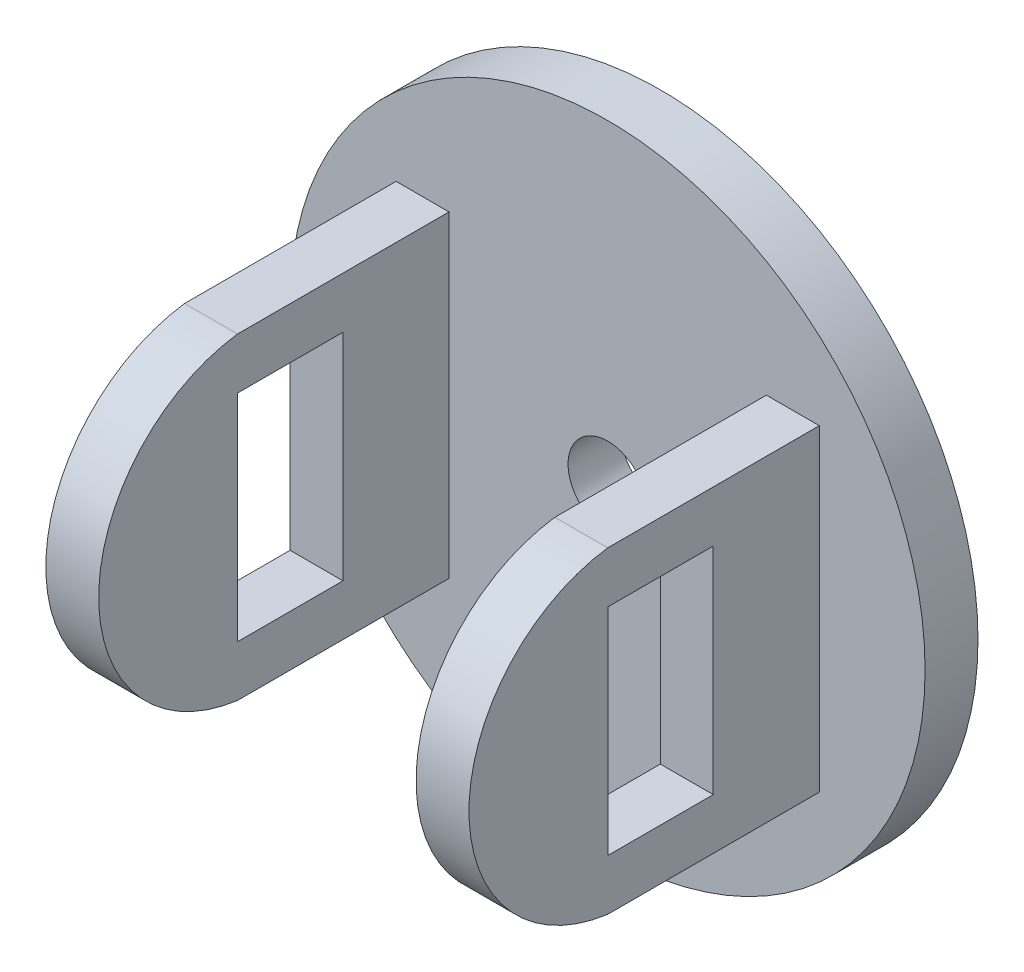
from build123d import *

# Parameters (mm, degrees)
SKETCH_1_R          = 60
EXTRUDE_1_DEPTH     = 10
SKETCH_3_W          = 19.9
SKETCH_3_H          = 40.7
EXTRUDE_4_DEPTH     = 10
SKETCH_10_W         = 19.9
SKETCH_10_H         = 40.7
EXTRUDE_7_DEPTH     = 10
SKETCH_11_R         = 7.5
CUT_EXTRUDE_1_DEPTH = 108.636941111


with BuildPart() as part:
    # 스케치1 → 보스-돌출1 (new body)
    with BuildSketch(Plane.XY):
        Circle(SKETCH_1_R)
    extrude(amount=EXTRUDE_1_DEPTH)

    # 스케치3 → 보스-돌출4 (add)
    with BuildSketch(Plane(origin=(30, 0, 0), x_dir=(0, 0, -1), z_dir=(1, 0, 0))):
        with BuildLine():
            Line((-10, 0), (-10, 30.023943052))
            Line((-10, 30.023943052), (-50, 30.023943052))
            ThreePointArc((-50, 30.023943052), (-76.224701523, 0.023943052), (-50, -29.976056948))
            Line((-50, -29.976056948), (-10, -29.976056948))
            Line((-10, -29.976056948), (-10, 0))
        make_face()
        with Locations((-40, 0)):
            Rectangle(SKETCH_3_W, SKETCH_3_H, mode=Mode.SUBTRACT)
    extrude(amount=EXTRUDE_4_DEPTH)

    # 스케치10 → 보스-돌출7 (add)
    with BuildSketch(Plane(origin=(-40, 0, 0), x_dir=(0, 0, -1), z_dir=(1, 0, 0))):
        with BuildLine():
            Line((-10, 30.023943052), (-50, 30.023943052))
            ThreePointArc((-50, 30.023943052), (-76.224701523, 0.023943052), (-50, -29.976056948))
            Line((-50, -29.976056948), (-10, -29.976056948))
            Line((-10, -29.976056948), (-10, 30.023943052))
        make_face()
        with Locations((-40, 0)):
            Rectangle(SKETCH_10_W, SKETCH_10_H, mode=Mode.SUBTRACT)
    extrude(amount=EXTRUDE_7_DEPTH)

    # 스케치11 → 컷-돌출1 (cut, through all)
    with BuildSketch(Plane.XY.offset(10)):
        Circle(SKETCH_11_R)
    extrude(amount=-CUT_EXTRUDE_1_DEPTH, mode=Mode.SUBTRACT)


solid = part.part
